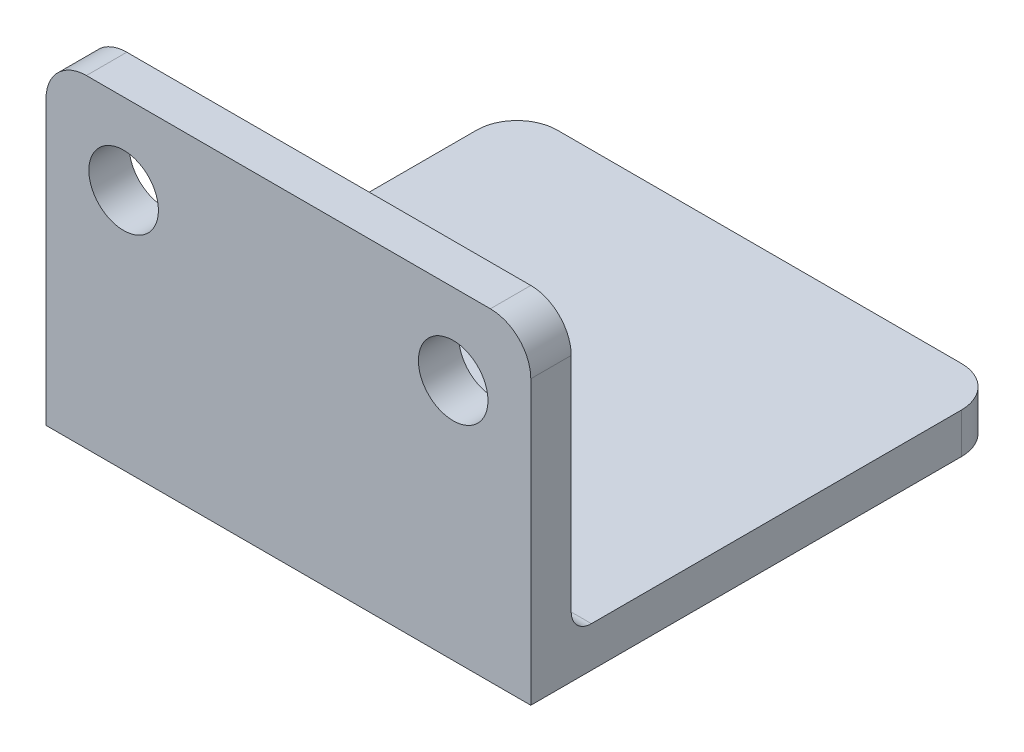
from build123d import *

# Parameters (mm, degrees)
EXTRUDE_THIN1_DEPTH = 76.2
FILLET1_R           = 6.35
SKETCH3_R           = 5.470235349
CUT_EXTRUDE2_DEPTH  = 76.2
FILLET2_R           = 3.175


with BuildPart() as part:
    # Sketch1 → Extrude-Thin1 (new body)
    with BuildSketch(Plane(origin=(0, 0, 0), x_dir=(0, 0, -1), z_dir=(1, 0, 0))):
        Polygon((74.026491926, 0), (0, 0), (0, 50.8), (6.35, 50.8), (6.35, 6.35), (74.026491926, 6.35), align=None)
    extrude(amount=EXTRUDE_THIN1_DEPTH)

    # Fillet1
    fillet1_edges = [part.edges().sort_by_distance(p)[0] for p in [
        (76.2, 3.175, -74.026491926),
        (0, 3.175, -74.026491926),
        (0, 50.8, -3.175),
        (76.2, 50.8, -3.175),
    ]]
    fillet(fillet1_edges, radius=FILLET1_R)

    # Sketch3 → Cut-Extrude2 (cut)
    with BuildSketch(Plane.XY):
        with Locations((12.201854518, 38.1)):
            Circle(SKETCH3_R)
        with Locations((63.998145482, 38.1)):
            Circle(SKETCH3_R)
    extrude(amount=-CUT_EXTRUDE2_DEPTH, mode=Mode.SUBTRACT)

    # Fillet2
    fillet2_edges = [part.edges().sort_by_distance(p)[0] for p in [
        (38.1, 6.35, -6.35),
    ]]
    fillet(fillet2_edges, radius=FILLET2_R)


solid = part.part
